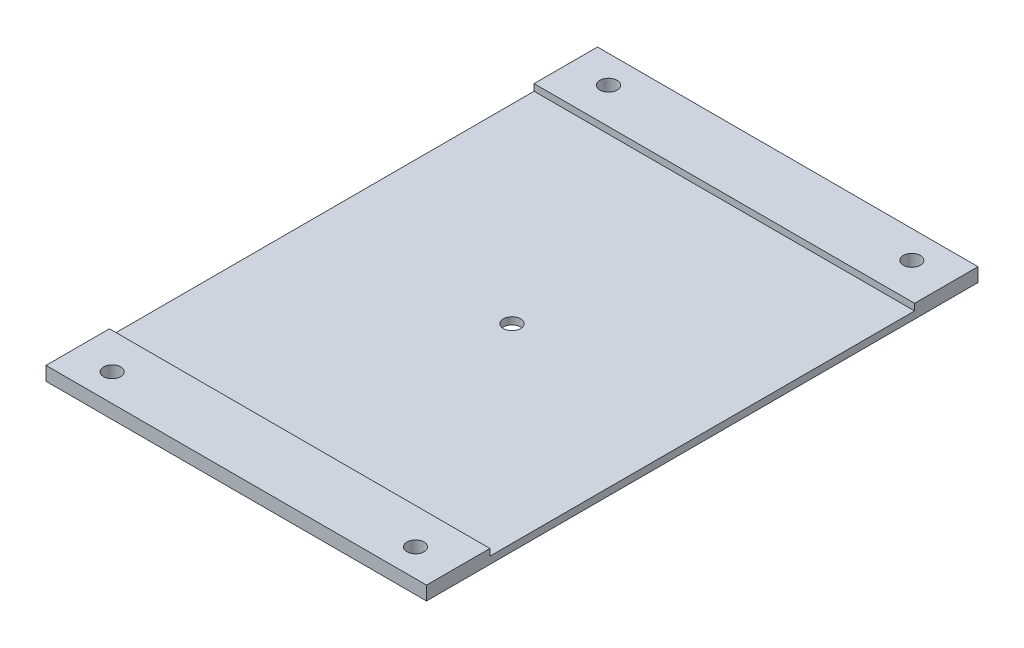
from build123d import *

# Parameters (mm, degrees)
SKETCH1_W              = 69
SKETCH1_H              = 100
BOSS_EXTRUDE1_DEPTH    = 2.5
SKETCH2_W              = 69
SKETCH2_H              = 77
CUT_EXTRUDE1_DEPTH     = 1.2
M2_5_CLEARANCE_HOLE1_D = 3.1


with BuildPart() as part:
    # Sketch1 → Boss-Extrude1 (new body)
    with BuildSketch(Plane(origin=(0, 0, 0), x_dir=(1, 0, 0), z_dir=(0, 1, 0))):
        Rectangle(SKETCH1_W, SKETCH1_H)
    extrude(amount=BOSS_EXTRUDE1_DEPTH)

    # Sketch2 → Cut-Extrude1 (cut)
    with BuildSketch(Plane(origin=(0, 2.5, 0), x_dir=(1, 0, 0), z_dir=(0, 1, 0))):
        Rectangle(SKETCH2_W, SKETCH2_H)
    extrude(amount=-CUT_EXTRUDE1_DEPTH, mode=Mode.SUBTRACT)

    # M2.5 Clearance Hole1 (through all)
    with Locations(Plane(origin=(0, 2.5, 0), x_dir=(1, 0, 0), z_dir=(0, 1, 0))):
        with Locations((-27.5, 45), (27.5, 45), (-27.5, -45), (27.5, -45), (0, 0)):
            Hole(M2_5_CLEARANCE_HOLE1_D / 2)


solid = part.part
